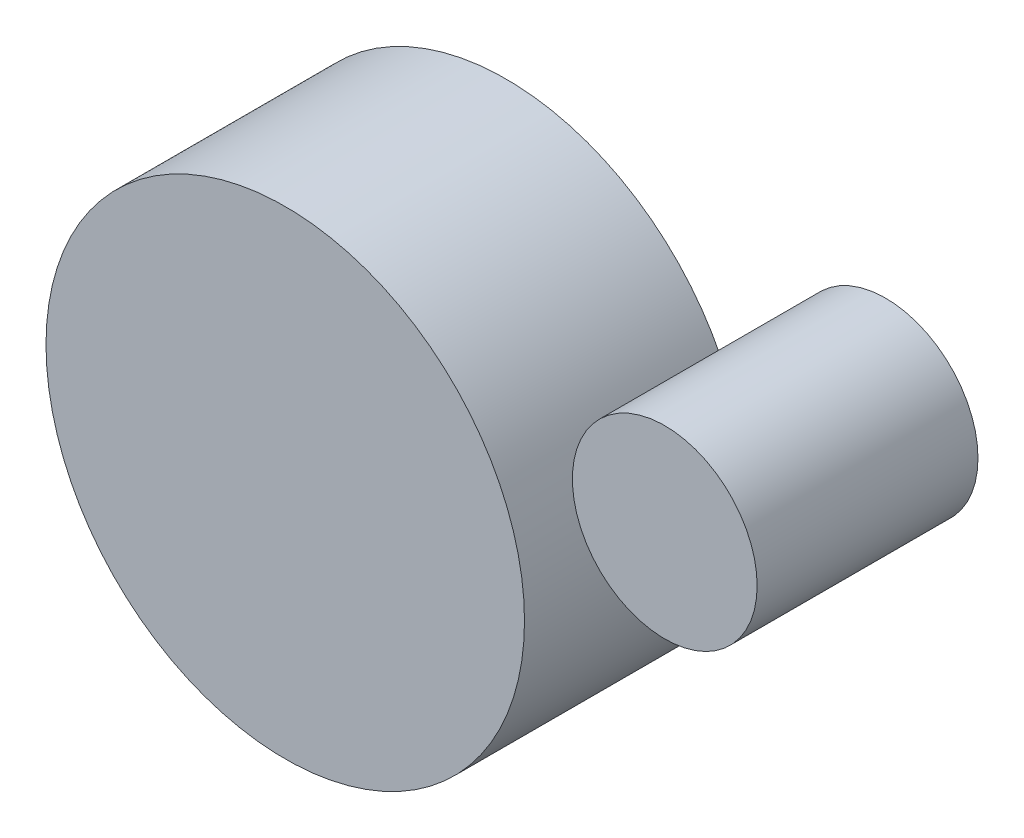
from build123d import *

# Parameters (mm, degrees)
CROQUIS1_R                = 12.55
SALIENTE_EXTRUIR1_DEPTH   = 30
CROQUIS1_R_2              = 32.5
SALIENTE_EXTRUIR1_2_DEPTH = 30


with BuildPart() as part:
    # Croquis1 → Saliente-Extruir1 (new body)
    with BuildSketch(Plane.XY):
        with Locations((44.9, 27)):
            Circle(CROQUIS1_R)
    extrude(amount=SALIENTE_EXTRUIR1_DEPTH)


with BuildPart() as body_2:
    # Croquis1 → Saliente-Extruir1 2 (new body)
    with BuildSketch(Plane.XY):
        with Locations((-6.65, 7.05)):
            Circle(CROQUIS1_R_2)
    extrude(amount=SALIENTE_EXTRUIR1_2_DEPTH)


solid = Compound([part.part, body_2.part])
